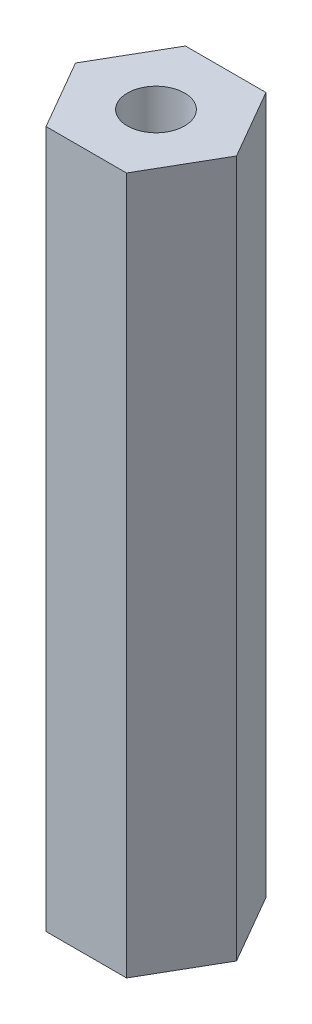
from build123d import *

# Parameters (mm, degrees)
SKETCH_1_R      = 1.025
EXTRUDE_1_DEPTH = 25


with BuildPart() as part:
    # 草图1 → 凸台-拉伸1 (new body)
    with BuildSketch(Plane.XZ):
        Polygon((-1.443375673, -2.5), (1.443375673, -2.5), (2.886751346, 0), (1.443375673, 2.5), (-1.443375673, 2.5), (-2.886751346, 0), align=None)
        with Locations(Location((0, 0, 0), (0, 0, 90))):
            Circle(SKETCH_1_R, mode=Mode.SUBTRACT)
    extrude(amount=-EXTRUDE_1_DEPTH)


solid = part.part
